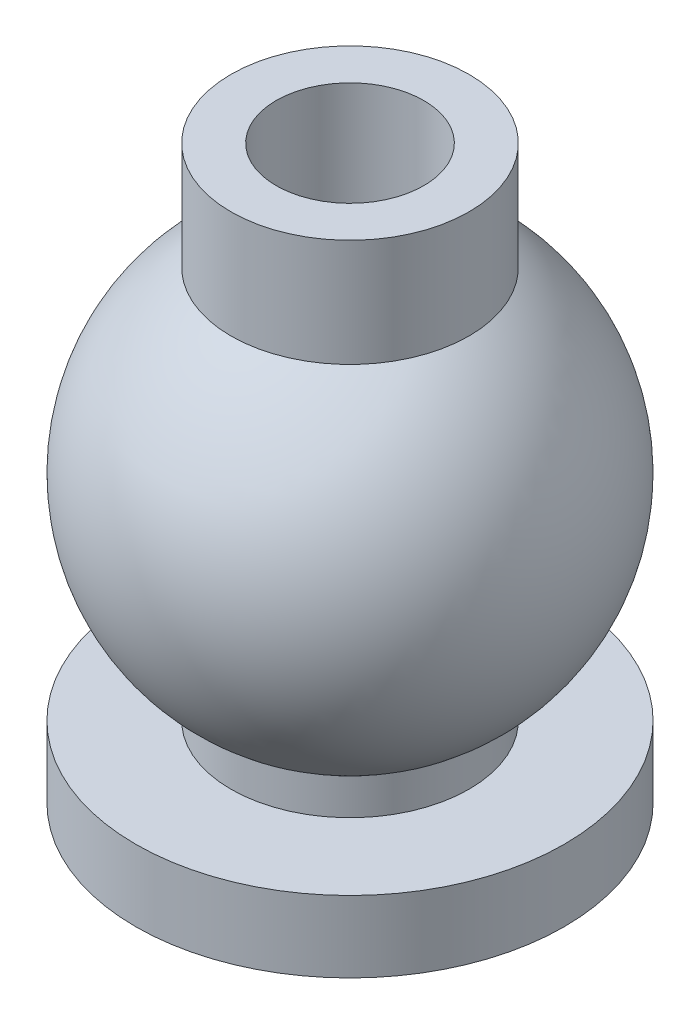
from build123d import *


with BuildPart() as part:
    # Sketch1 → Revolve1 (revolve)
    with BuildSketch(Plane.XY, mode=Mode.PRIVATE) as revolve1_sk:
        with BuildLine():
            Line((1.55, -6), (4.5, -6))
            Line((4.5, -6), (4.5, -4.5))
            Line((4.5, -4.5), (2.5, -4.5))
            Line((2.5, -4.5), (2.5, -3.741657387))
            ThreePointArc((2.5, -3.741657387), (4.5, 0), (2.5, 3.741657387))
            Line((2.5, 3.741657387), (2.5, 6))
            Line((2.5, 6), (1.55, 6))
            Line((1.55, 6), (1.55, -6))
        make_face()
    revolve(revolve1_sk.sketch.rotate(Axis((0, 6.83647591, 0), (0, -1, 0)), 180), axis=Axis((0, 6.83647591, 0), (0, -1, 0)))


solid = part.part
